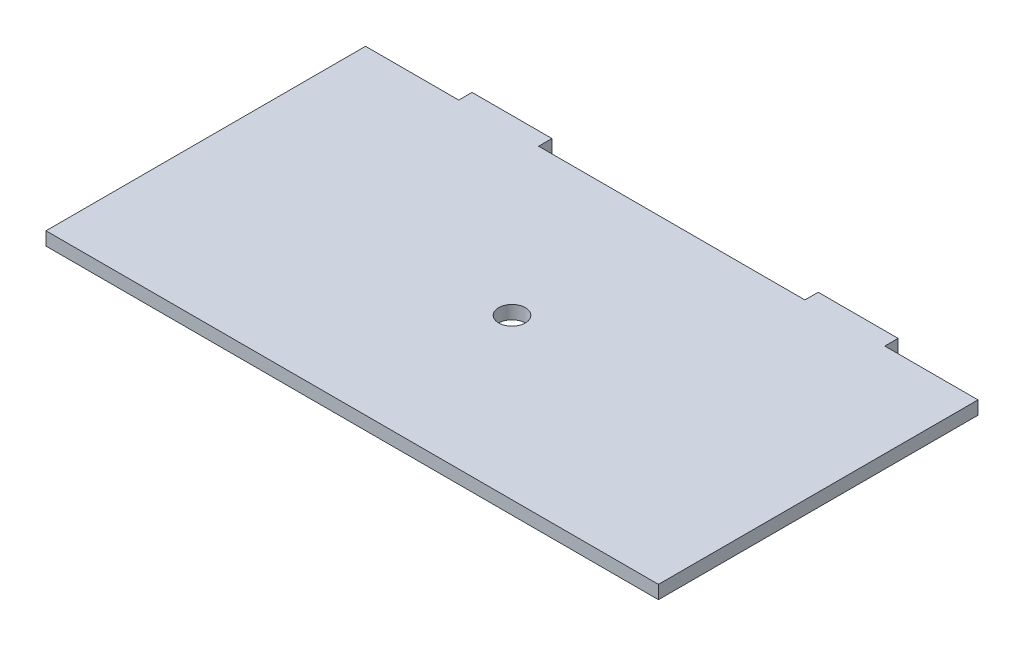
from build123d import *

# Parameters (mm, degrees)
SKETCH1_R           = 3.175
BOSS_EXTRUDE1_DEPTH = 3.175


with BuildPart() as part:
    # Sketch1 → Boss-Extrude1 (new body)
    with BuildSketch(Plane(origin=(0, 0, 0), x_dir=(1, 0, 0), z_dir=(0, 1, 0))):
        Polygon((41.275, 76.2), (104.775, 76.2), (104.775, 79.375), (123.825, 79.375), (123.825, 76.2), (146.05, 76.2), (146.05, 0), (0, 0), (0, 76.2), (22.225, 76.2), (22.225, 79.375), (41.275, 79.375), align=None)
        with Locations(Location((73.025, 38.1, 0), (0, 0, 270))):
            Circle(SKETCH1_R, mode=Mode.SUBTRACT)
    extrude(amount=BOSS_EXTRUDE1_DEPTH)


solid = part.part
